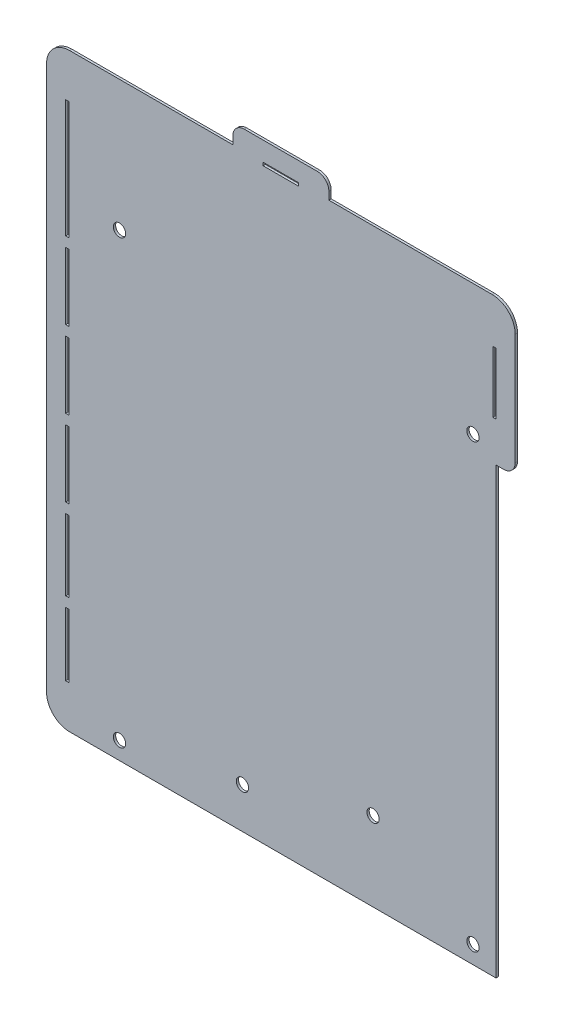
from build123d import *

# Parameters (mm, degrees)
BOSS_EXTRUDE1_DEPTH = 0.6
SKETCH14_R          = 1.6
SKETCH14_W          = 0.8
SKETCH14_H          = 30.7
SKETCH14_H_2        = 16.55
SKETCH14_H_3        = 17.4
SKETCH14_H_4        = 18.55
SKETCH14_H_5        = 16
CUT_EXTRUDE1_DEPTH  = 216.986998667
FILLET3_R           = 6
SKETCH15_R          = 1.6
CUT_EXTRUDE2_DEPTH  = 216.986998667
SKETCH16_W          = 25
SKETCH16_H          = 5
BOSS_EXTRUDE2_DEPTH = 0.6
SKETCH17_W          = 9.2
SKETCH17_H          = 0.8
CUT_EXTRUDE3_DEPTH  = 221.288877768
FILLET4_R           = 3


with BuildPart() as part:
    # Sketch2 → Boss-Extrude1 (new body)
    with BuildSketch(Plane.XY):
        Polygon((106.16728925, 147.241288665), (106.16728925, 31.58105), (24.16705825, 31.58105), (-10.832812, 31.58105), (-10.832812, 185.1806075), (24.16705825, 185.1806075), (106.16728925, 185.1806075), (111.16728925, 185.1806075), (111.16728925, 147.241288665), align=None)
    extrude(amount=BOSS_EXTRUDE1_DEPTH)

    # Sketch14 → Cut-Extrude1 (cut, through all)
    with BuildSketch(Plane.XY.offset(0.6)):
        with Locations((100.166839875, 36.181495)):
            Circle(SKETCH14_R)
        with Locations((8.167632375, 36.181495)):
            Circle(SKETCH14_R)
        with Locations((8.167632375, 151.18016)):
            Circle(SKETCH14_R)
        with Locations((100.166839875, 151.18016)):
            Circle(SKETCH14_R)
        with Locations((-5.432812, 158.23105)):
            Rectangle(SKETCH14_W, SKETCH14_H)
        with Locations((-5.432812, 50.85605)):
            Rectangle(SKETCH14_W, SKETCH14_H_2)
        with Locations((-5.432812, 131.58105)):
            Rectangle(SKETCH14_W, SKETCH14_H_3)
        with Locations((-5.432812, 71.00605)):
            Rectangle(SKETCH14_W, SKETCH14_H_4)
        with Locations((-5.432812, 91.58105)):
            Rectangle(SKETCH14_W, SKETCH14_H_3)
        with Locations((-5.432812, 111.58105)):
            Rectangle(SKETCH14_W, SKETCH14_H_3)
        with Locations((105.76728925, 165.58105)):
            Rectangle(SKETCH14_W, SKETCH14_H_5)
    extrude(amount=-CUT_EXTRUDE1_DEPTH, mode=Mode.SUBTRACT)

    # Fillet3
    fillet3_edges = [part.edges().sort_by_distance(p)[0] for p in [
        (111.16728925, 185.1806075, 0.3),
        (-10.832812, 31.58105, 0.3),
        (-10.832812, 185.1806075, 0.3),
    ]]
    fillet(fillet3_edges, radius=FILLET3_R)

    # Sketch15 → Cut-Extrude2 (cut, through all)
    with BuildSketch(Plane.XY.offset(0.6)):
        with Locations((74.166839875, 52.181495)):
            Circle(SKETCH15_R)
        with Locations((40.166839875, 42.181495)):
            Circle(SKETCH15_R)
    extrude(amount=-CUT_EXTRUDE2_DEPTH, mode=Mode.SUBTRACT)

    # Sketch16 → Boss-Extrude2 (add)
    with BuildSketch(Plane.XY.offset(0.6)):
        with Locations((50.16728925, 187.6806075)):
            Rectangle(SKETCH16_W, SKETCH16_H)
    extrude(amount=-BOSS_EXTRUDE2_DEPTH)

    # Sketch17 → Cut-Extrude3 (cut, through all)
    with BuildSketch(Plane.XY.offset(0.6)):
        with Locations((50.16728925, 184.7806075)):
            Rectangle(SKETCH17_W, SKETCH17_H)
    extrude(amount=-CUT_EXTRUDE3_DEPTH, mode=Mode.SUBTRACT)

    # Fillet4
    fillet4_edges = [part.edges().sort_by_distance(p)[0] for p in [
        (111.16728925, 147.241288665, 0.3),
        (37.66728925, 190.1806075, 0.3),
        (62.66728925, 190.1806075, 0.3),
    ]]
    fillet(fillet4_edges, radius=FILLET4_R)


solid = part.part
